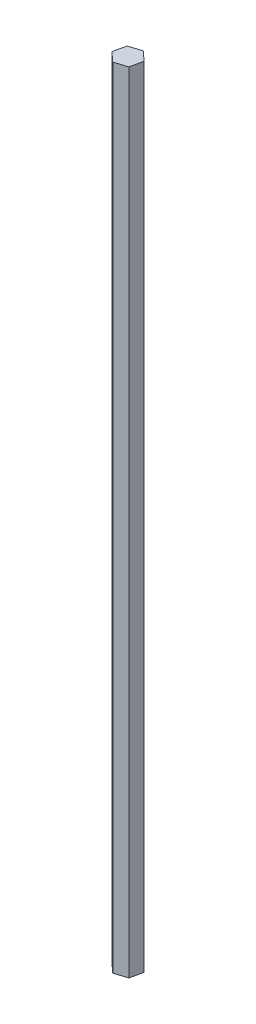
from build123d import *

# Parameters (mm, degrees)
BOSS_EXTRUDE1_DEPTH = 177.8


with BuildPart() as part:
    # Sketch2 → Boss-Extrude1 (new body)
    with BuildSketch(Plane(origin=(0, 0, 0), x_dir=(1, 0, 0), z_dir=(0, 1, 0))):
        Polygon((2.137295047, -1.940438924), (2.749116926, 0.880732344), (0.611821879, 2.821171268), (-2.137295047, 1.940438924), (-2.749116926, -0.880732344), (-0.611821879, -2.821171268), align=None)
    extrude(amount=BOSS_EXTRUDE1_DEPTH)


solid = part.part
